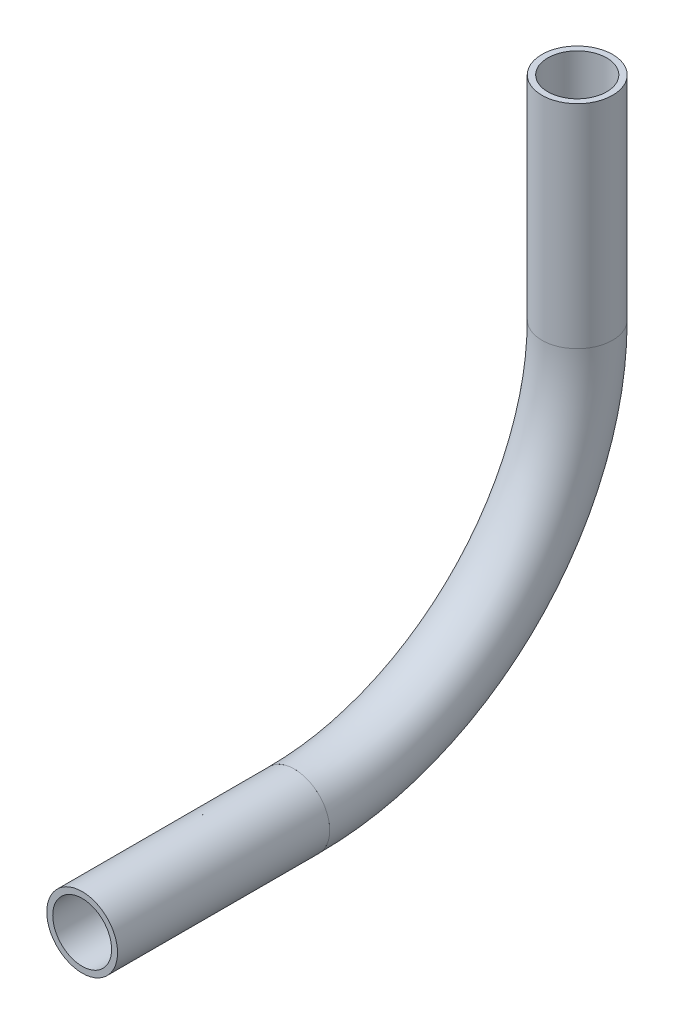
from build123d import *

# Parameters (mm, degrees)
SKETCH1_R                 = 6.35
SKETCH1_R_2               = 5.2832
PIPE_0_5_SCH_40_1_DEPTH   = 38.1
SKETCH1_ON_SEGMENT_2_R    = 6.35
SKETCH1_ON_SEGMENT_2_R_2  = 5.2832
PIPE_0_5_SCH_40_1_2_ANGLE = 90
SKETCH1_ON_SEGMENT_3_R    = 6.35
SKETCH1_ON_SEGMENT_3_R_2  = 5.2832
PIPE_0_5_SCH_40_1_3_DEPTH = 38.1


with BuildPart() as part:
    # Sketch1 → Pipe 0.5 SCH 40(1) (new body)
    with BuildSketch(Plane(origin=(0, -187.848883234, 259.179579455), x_dir=(0, 0, -1), z_dir=(0, -1, 0))):
        Circle(SKETCH1_R)
        Circle(SKETCH1_R_2, mode=Mode.SUBTRACT)
    extrude(amount=PIPE_0_5_SCH_40_1_DEPTH)


with BuildPart() as body_2:
    # Sketch1 on segment 2 (carried to the start of arc 2) → Pipe 0.5 SCH 40_1 2 (revolve)
    with BuildSketch(Plane(origin=(0, -225.948883234, 259.179579455), x_dir=(0, 0, -1), z_dir=(0, -1, 0))):
        Circle(SKETCH1_ON_SEGMENT_2_R)
        Circle(SKETCH1_ON_SEGMENT_2_R_2, mode=Mode.SUBTRACT)
    revolve(axis=Axis((0, -225.948883234, 309.979579455), (-1, 0, 0)), revolution_arc=PIPE_0_5_SCH_40_1_2_ANGLE)


with BuildPart() as body_3:
    # Sketch1 on segment 3 (carried to segment 3) → Pipe 0.5 SCH 40_1 3 (new body)
    with BuildSketch(Plane(origin=(0, -276.748883234, 309.979579455), x_dir=(0, -1, 0), z_dir=(0, 0, 1))):
        Circle(SKETCH1_ON_SEGMENT_3_R)
        Circle(SKETCH1_ON_SEGMENT_3_R_2, mode=Mode.SUBTRACT)
    extrude(amount=PIPE_0_5_SCH_40_1_3_DEPTH)


solid = Compound([part.part, body_2.part, body_3.part])
